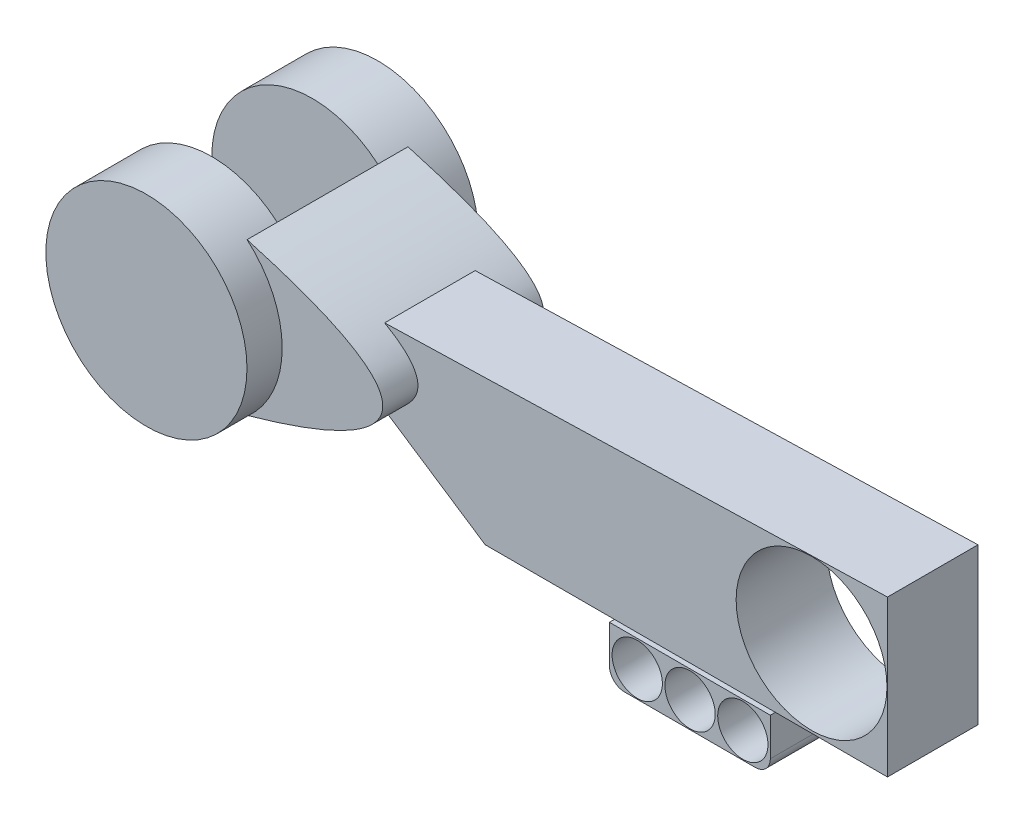
from build123d import *

# Parameters (mm, degrees)
BOSS_EXTRUDE1_START      = -1.2
SKETCH1_R                = 2
BOSS_EXTRUDE1_DEPTH      = 1.3
BOSS_EXTRUDE2_START      = 1
BOSS_EXTRUDE2_DEPTH      = 1.6
BOSS_EXTRUDE3_DEPTH      = 0.9
SKETCH6_R                = 1.5
CUT_EXTRUDE13_DEPTH      = 2.5
BOSS_EXTRUDE4_DEPTH      = 0.0001
BOSS_EXTRUDE4_DEPTH_BACK = 2
SKETCH9_R                = 0.5


with BuildPart() as part:
    # Sketch1 → Boss-Extrude1 (new body)
    with BuildSketch(Plane.XY.offset(BOSS_EXTRUDE1_START)):
        Circle(SKETCH1_R)
    boss_extrude1 = extrude(amount=BOSS_EXTRUDE1_DEPTH)

    # Sketch2 → Boss-Extrude2 (add)
    with BuildSketch(Plane(origin=(0, 0, -1.2), x_dir=(-1, 0, 0), z_dir=(0, 0, -1)).offset(BOSS_EXTRUDE2_START)):
        with BuildLine():
            ThreePointArc((-1.301905334, 1.518236642), (-1.999965901, 0.011678742), (-1.31954734, -1.502928747))
            add(Edge.make_bspline(
                [(-1.301905334, 1.518236642), (-6.689282212, 0.003550345), (-1.31954734, -1.502928747)],
                knots=[0, 0, 0, 1, 1, 1], degree=2))
        make_face()
    boss_extrude2 = extrude(amount=-BOSS_EXTRUDE2_DEPTH)

    # Sketch3 → Boss-Extrude3 (add)
    with BuildSketch(Plane(origin=(0, 0, -2.2), x_dir=(-1, 0, 0), z_dir=(0, 0, -1))):
        with BuildLine():
            Line((-5.337512996, -2.068499627), (-3.337513, -0.746121009))
            add(Edge.make_bspline(
                [(-3.337512996, 0.753381422), (-4.662510017, 0.002619292), (-3.337513, -0.746121009)],
                knots=[0.252652683, 0.252652683, 0.252652683, 0.748987348, 0.748987348, 0.748987348], degree=2))
            Line((-3.337513, 0.753381429), (-13.337512996, 1.031500373))
            Line((-13.337512996, 1.031500373), (-13.337512996, -2.068499627))
            Line((-13.337512996, -2.068499627), (-5.337512996, -2.068499627))
        make_face()
    boss_extrude3 = extrude(amount=-BOSS_EXTRUDE3_DEPTH)

    # Sketch6 → Cut-Extrude13 (cut, symmetric)
    with BuildSketch(Plane.XY.offset(-1.3)):
        with Locations((11.827512996, -0.521079469)):
            Circle(SKETCH6_R)
    cut_extrude13 = extrude(amount=CUT_EXTRUDE13_DEPTH, both=True, mode=Mode.SUBTRACT)

    # Mirror2: Boss-Extrude2, Boss-Extrude3 across plane
    add(boss_extrude2.mirror(Plane(origin=(0, 0, -2.2), x_dir=(1, 0, 0), z_dir=(0, 0, -1))))
    add(boss_extrude3.mirror(Plane(origin=(0, 0, -2.2), x_dir=(1, 0, 0), z_dir=(0, 0, -1))))

    # Mirror3: Boss-Extrude1 across plane
    add(boss_extrude1.mirror(Plane(origin=(0, 0, -2.2), x_dir=(1, 0, 0), z_dir=(0, 0, -1))))

    # Mirror4: Cut-Extrude13 across plane
    add(cut_extrude13.mirror(Plane(origin=(0, 0, -2.2), x_dir=(1, 0, 0), z_dir=(0, 0, -1))), mode=Mode.SUBTRACT)

    # Sketch9 → Boss-Extrude4 (add, two sides: drawn at the far end of the back side and taken through both)
    with BuildSketch(Plane(origin=(0, 0, -3.2), x_dir=(-1, 0, 0), z_dir=(0, 0, -1)).offset(-BOSS_EXTRUDE4_DEPTH_BACK)):
        with BuildLine():
            Line((-11.107531907, -2.068499627), (-7.907531907, -2.068499627))
            Line((-7.907531907, -2.068499627), (-7.907531907, -2.818499627))
            ThreePointArc((-7.907531907, -2.818499627), (-7.995399873, -3.030631662), (-8.207531907, -3.118499627))
            Line((-8.207531907, -3.118499627), (-10.807531907, -3.118499627))
            ThreePointArc((-10.807531907, -3.118499627), (-11.019663942, -3.030631662), (-11.107531907, -2.818499627))
            Line((-11.107531907, -2.818499627), (-11.107531907, -2.068499627))
        make_face()
        with Locations((-10.560929332, -2.601747045)):
            Circle(SKETCH9_R, mode=Mode.SUBTRACT)
        with Locations((-9.510929332, -2.601747045)):
            Circle(SKETCH9_R, mode=Mode.SUBTRACT)
        with Locations((-8.460929332, -2.601747045)):
            Circle(SKETCH9_R, mode=Mode.SUBTRACT)
    extrude(amount=BOSS_EXTRUDE4_DEPTH + BOSS_EXTRUDE4_DEPTH_BACK)


solid = part.part
